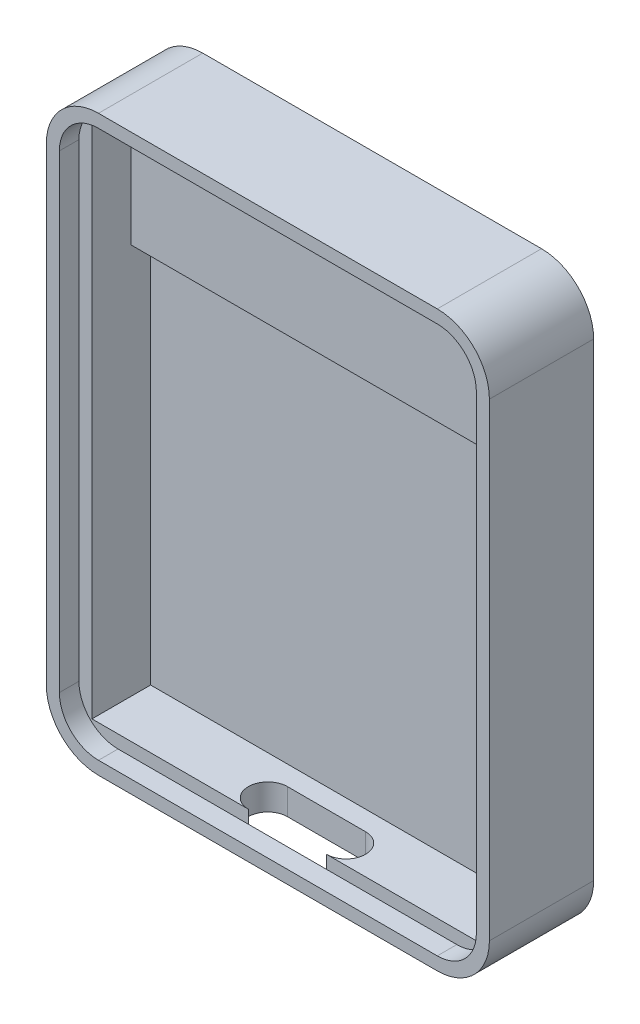
from build123d import *

# Parameters (mm, degrees)
SKETCH_1_W          = 34
SKETCH_1_H          = 44
EXTRUDE_1_DEPTH     = 8
SKETCH_2_W          = 30
SKETCH_2_H          = 40
CUT_EXTRUDE_1_DEPTH = 4.5
SKETCH_3_W          = 30
SKETCH_3_H          = 30
CUT_EXTRUDE_2_DEPTH = 1.5
FILLET_1_R          = 4
CUT_EXTRUDE_3_DEPTH = 2
CUT_EXTRUDE_4_DEPTH = 1.5


with BuildPart() as part:
    # Эскиз1 → Бобышка-Вытянуть1 (new body)
    with BuildSketch(Plane.XY):
        Rectangle(SKETCH_1_W, SKETCH_1_H)
    extrude(amount=EXTRUDE_1_DEPTH)

    # Эскиз2 → Вырез-Вытянуть1 (cut)
    with BuildSketch(Plane.XY.offset(8)):
        Rectangle(SKETCH_2_W, SKETCH_2_H)
    extrude(amount=-CUT_EXTRUDE_1_DEPTH, mode=Mode.SUBTRACT)

    # Эскиз3 → Вырез-Вытянуть2 (cut)
    with BuildSketch(Plane.XY.offset(3.5)):
        with Locations((0, -5)):
            Rectangle(SKETCH_3_W, SKETCH_3_H)
    extrude(amount=-CUT_EXTRUDE_2_DEPTH, mode=Mode.SUBTRACT)

    # Скругление1
    fillet_1_edges = [part.edges().sort_by_distance(p)[0] for p in [
        (17, -22, 4),
        (-17, -22, 4),
        (-17, 22, 4),
        (17, 22, 4),
    ]]
    fillet(fillet_1_edges, radius=FILLET_1_R)

    # Эскиз4 → Вырез-Вытянуть3 (cut)
    with BuildSketch(Plane.XZ.offset(22)):
        with BuildLine():
            Line((-3, 6.5), (3, 6.5))
            ThreePointArc((3, 6.5), (4.5, 5), (3, 3.5))
            Line((3, 3.5), (-3, 3.5))
            ThreePointArc((-3, 3.5), (-4.5, 5), (-3, 6.5))
        make_face()
    extrude(amount=-CUT_EXTRUDE_3_DEPTH, mode=Mode.SUBTRACT)

    # Эскиз5 → Вырез-Вытянуть4 (cut)
    with BuildSketch(Plane.XY.offset(8)):
        with BuildLine():
            Line((-13, -21), (13, -21))
            ThreePointArc((13, -21), (15.121320344, -20.121320344), (16, -18))
            Line((16, -18), (16, 18))
            ThreePointArc((16, 18), (15.121320344, 20.121320344), (13, 21))
            Line((13, 21), (-13, 21))
            ThreePointArc((-13, 21), (-15.121320344, 20.121320344), (-16, 18))
            Line((-16, 18), (-16, -18))
            ThreePointArc((-16, -18), (-15.121320344, -20.121320344), (-13, -21))
        make_face()
    extrude(amount=-CUT_EXTRUDE_4_DEPTH, mode=Mode.SUBTRACT)


solid = part.part
